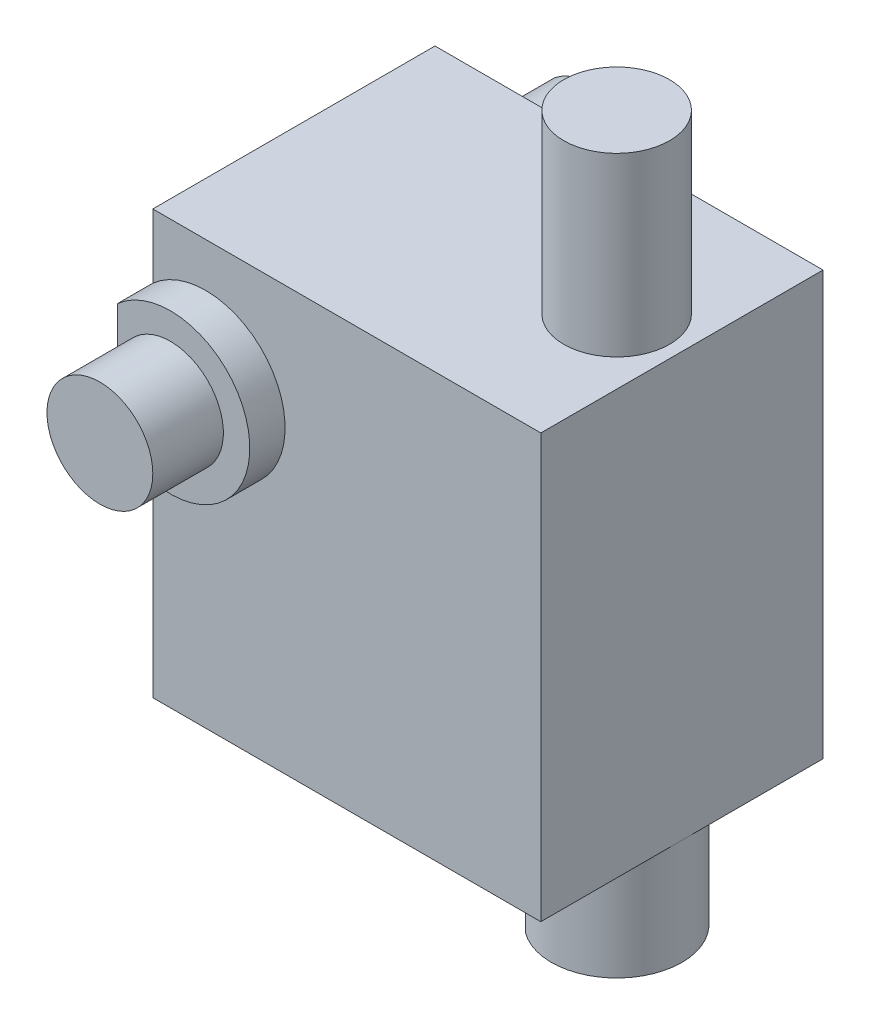
from build123d import *

# Parameters (mm, degrees)
BOSS_EXTRUDE1_DEPTH = 3
SKETCH2_W           = 11
SKETCH2_H           = 8
BOSS_EXTRUDE2_DEPTH = 12
SKETCH4_R           = 1.5
BOSS_EXTRUDE4_DEPTH = 5
BOSS_EXTRUDE5_DEPTH = 5
SKETCH3_R           = 1.5
BOSS_EXTRUDE3_DEPTH = 2
BOSS_EXTRUDE6_DEPTH = 2


with BuildPart() as part:
    # Sketch1 → Boss-Extrude1 (new body)
    with BuildSketch(Plane(origin=(0, 0, 0), x_dir=(1, 0, 0), z_dir=(0, 1, 0))):
        with BuildLine():
            Line((-1.1, 1.487447478), (-1.1, -1.487447478))
            ThreePointArc((-1.1, -1.487447478), (1.85, 0), (-1.1, 1.487447478))
        make_face()
    extrude(amount=BOSS_EXTRUDE1_DEPTH)

    # Sketch2 → Boss-Extrude2 (add)
    with BuildSketch(Plane(origin=(0, 3, 0), x_dir=(1, 0, 0), z_dir=(0, 1, 0))):
        with Locations((-3.65, 0)):
            Rectangle(SKETCH2_W, SKETCH2_H)
    extrude(amount=BOSS_EXTRUDE2_DEPTH)

    # Sketch4 → Boss-Extrude4 (add)
    with BuildSketch(Plane(origin=(0, 15, 0), x_dir=(1, 0, 0), z_dir=(0, 1, 0))):
        with Locations(Location((0, 0, 0), (0, 0, 270))):
            Circle(SKETCH4_R)
    extrude(amount=BOSS_EXTRUDE4_DEPTH)

    # Sketch5 → Boss-Extrude5 (add, symmetric)
    with BuildSketch(Plane.XY):
        with BuildLine():
            Line((-9.15, 13.177050983), (-9.15, 9.822949017))
            ThreePointArc((-9.15, 9.822949017), (-5.4, 11.5), (-9.15, 13.177050983))
        make_face()
    extrude(amount=BOSS_EXTRUDE5_DEPTH, both=True)

    # Sketch3 → Boss-Extrude3 (add)
    with BuildSketch(Plane.XY.offset(5)):
        with Locations(Location((-7.65, 11.5, 0), (0, 0, 180))):
            Circle(SKETCH3_R)
    extrude(amount=BOSS_EXTRUDE3_DEPTH)

    # Sketch6 → Boss-Extrude6 (add)
    with BuildSketch(Plane(origin=(0, 0, -5), x_dir=(-1, 0, 0), z_dir=(0, 0, -1))):
        with BuildLine():
            Line((8.75, 10.075219315), (8.75, 12.924780685))
            ThreePointArc((8.75, 12.924780685), (5.85, 11.5), (8.75, 10.075219315))
        make_face()
    extrude(amount=BOSS_EXTRUDE6_DEPTH)


solid = part.part
